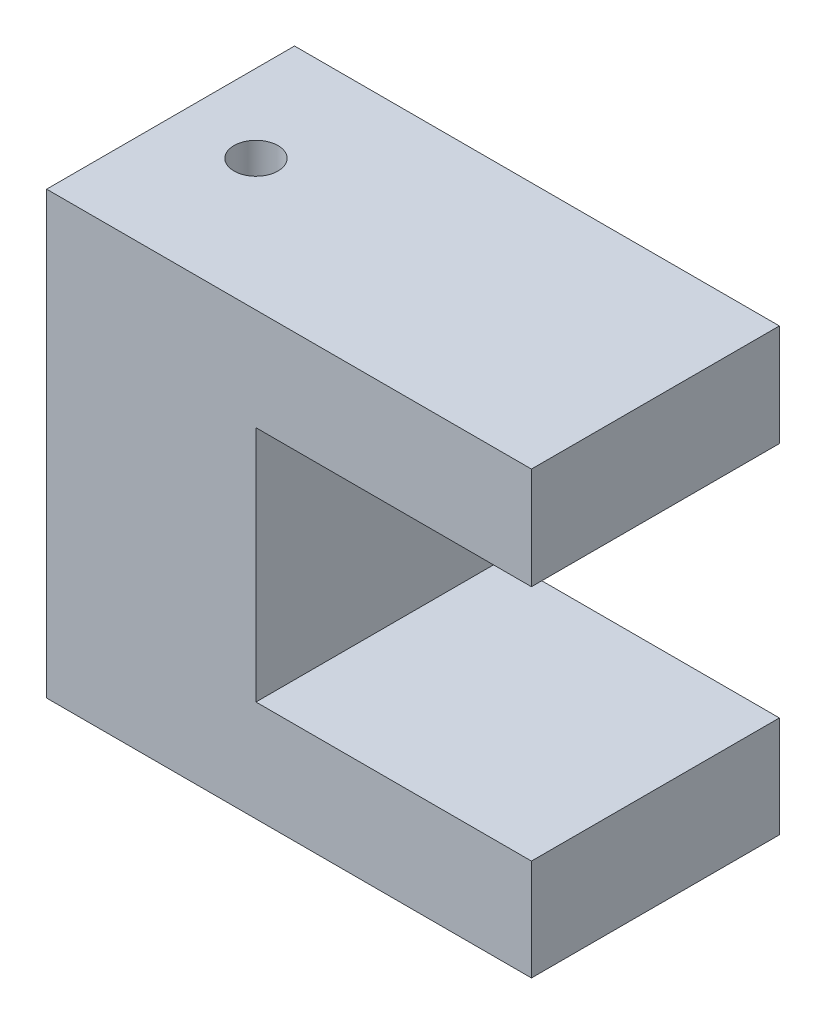
from build123d import *

# Parameters (mm, degrees)
IZIM1_W                     = 88
IZIM1_H                     = 80
Y_KSEKLIK_EKSTR_ZYON1_DEPTH = 45
IZIM2_W                     = 50
IZIM2_H                     = 43.119063511
KES_EKSTR_ZYON1_DEPTH       = 75.57211275
IZIM3_R                     = 4.00297174
KES_EKSTR_ZYON2_DEPTH       = 102.788997441


with BuildPart() as part:
    # Çizim1 → Yükseklik-Ekstrüzyon1 (new body)
    with BuildSketch(Plane.XY):
        Rectangle(IZIM1_W, IZIM1_H)
    extrude(amount=Y_KSEKLIK_EKSTR_ZYON1_DEPTH)

    # Çizim2 → Kes-Ekstrüzyon1 (cut, through all)
    with BuildSketch(Plane.XY.offset(45)):
        with Locations((19, -0.059531756)):
            Rectangle(IZIM2_W, IZIM2_H)
    extrude(amount=-KES_EKSTR_ZYON1_DEPTH, mode=Mode.SUBTRACT)

    # Çizim3 → Kes-Ekstrüzyon2 (cut, through all)
    with BuildSketch(Plane(origin=(0, 40, 0), x_dir=(1, 0, 0), z_dir=(0, 1, 0))):
        with Locations(Location((-29.85, -21.15, 0), (0, 0, 270))):
            Circle(IZIM3_R)
    extrude(amount=-KES_EKSTR_ZYON2_DEPTH, mode=Mode.SUBTRACT)


solid = part.part
